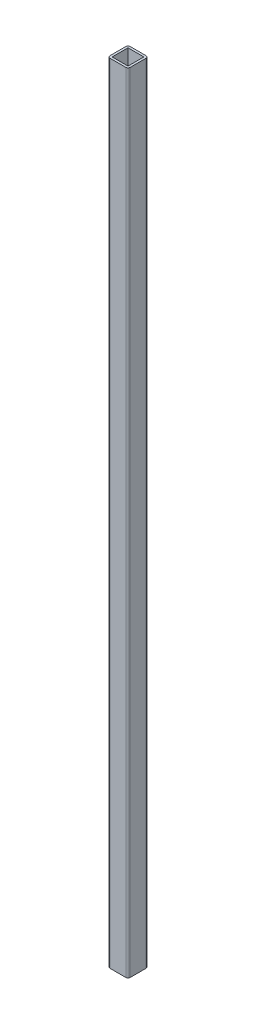
from build123d import *

# Parameters (mm, degrees)
BOSS_EXTRUDE1_DEPTH = 996.1
SKETCH3_W           = 20
SKETCH3_H           = 20
CUT_EXTRUDE1_DEPTH  = 1040.5


with BuildPart() as part:
    # Sketch1 → Boss-Extrude1 (new body)
    with BuildSketch(Plane(origin=(0, 0, 0), x_dir=(1, 0, 0), z_dir=(0, 1, 0))):
        with BuildLine():
            Line((2.8, 0), (22.8, 0))
            ThreePointArc((22.8, 0), (24.779898987, -0.820101013), (25.6, -2.8))
            Line((25.6, -2.8), (25.6, -22.8))
            ThreePointArc((25.6, -22.8), (24.779898987, -24.779898987), (22.8, -25.6))
            Line((22.8, -25.6), (2.8, -25.6))
            ThreePointArc((2.8, -25.6), (0.820101013, -24.779898987), (0, -22.8))
            Line((0, -22.8), (0, -2.8))
            ThreePointArc((0, -2.8), (0.820101013, -0.820101013), (2.8, 0))
        make_face()
    extrude(amount=BOSS_EXTRUDE1_DEPTH)

    # Sketch3 → Cut-Extrude1 (cut)
    with BuildSketch(Plane(origin=(0, 0, 0), x_dir=(-1, 0, 0), z_dir=(0, -1, 0))):
        with Locations((-12.8, -12.8)):
            Rectangle(SKETCH3_W, SKETCH3_H)
    extrude(amount=-CUT_EXTRUDE1_DEPTH, mode=Mode.SUBTRACT)


solid = part.part
